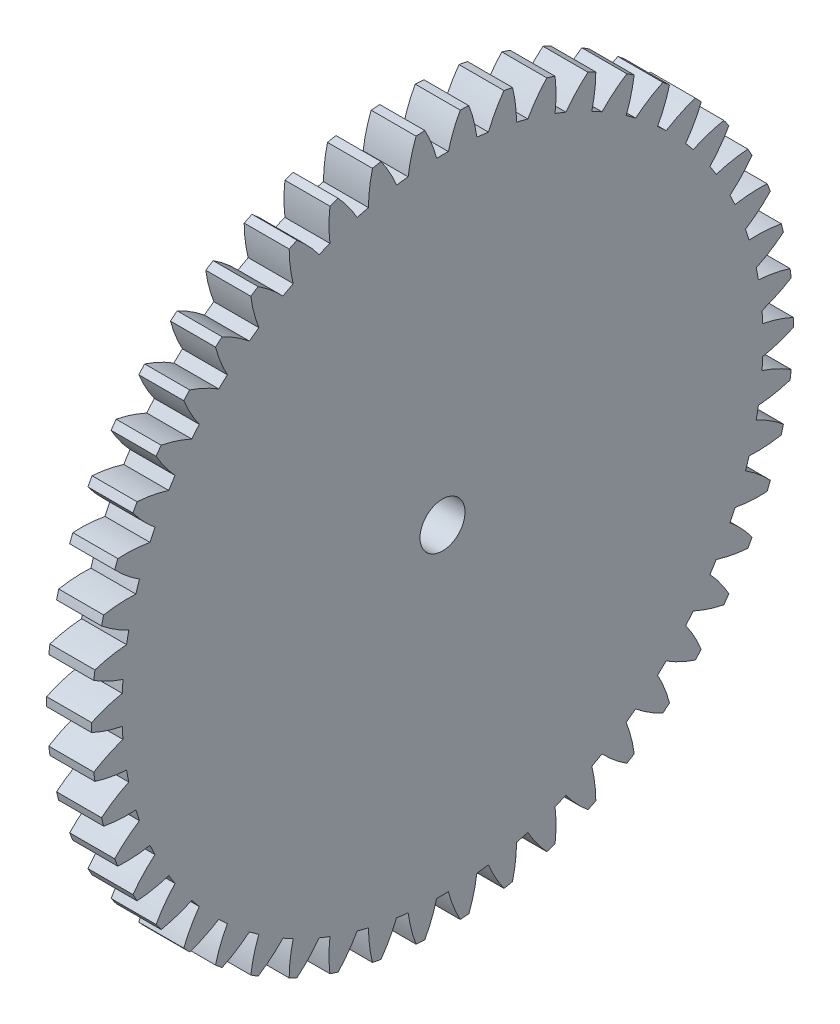
from build123d import *

# Parameters (mm, degrees)
BASPROSKE_W      = 5
BASPROSKE_H      = 39
TOOTHCUT_DEPTH   = 56.380501984
TEETHCUTS_COUNT  = 50
TEETHCUTS_ANGLE  = 352.8
HUBNEAONESKE_R   = 5
HUBNEARONE_DEPTH = 5.0000508
BORSKE_R         = 2.5
BORE_DEPTH       = 10.0000508


with BuildPart() as part:
    # BasProSke → Base-Revolve (revolve)
    with BuildSketch(Plane(origin=(0, 0, 0), x_dir=(1, 0, 0), z_dir=(0, 1, 0)), mode=Mode.PRIVATE) as base_revolve_sk:
        with Locations((2.5, 19.5)):
            Rectangle(BASPROSKE_W, BASPROSKE_H)
    revolve(base_revolve_sk.sketch.rotate(Axis((-10, 0, 0), (1, 0, 0)), 180), axis=Axis((-10, 0, 0), (1, 0, 0)))

    # TooCutSke → ToothCut (cut, through all)
    with BuildSketch(Plane(origin=(0, 0, 0), x_dir=(0, 0, -1), z_dir=(1, 0, 0))):
        with BuildLine():
            ThreePointArc((0.649974317, 35.618069984), (0, 35.624), (-0.649974317, 35.618069984))
            ThreePointArc((-0.649974317, 35.618069984), (-1.213667282, 37.336773563), (-1.980135572, 38.975131921))
            ThreePointArc((-1.980135572, 38.975131921), (0, 39.0254), (1.980135572, 38.975131921))
            ThreePointArc((1.980135572, 38.975131921), (1.213667282, 37.336773563), (0.649974317, 35.618069984))
        make_face()
    toothcut = extrude(amount=TOOTHCUT_DEPTH, mode=Mode.SUBTRACT)

    # TeethCuts: ToothCut ×50 about axis
    teethcuts_axis = Axis((-10, 0, 0), (1, 0, 0))
    for i in range(1, TEETHCUTS_COUNT):
        add(toothcut.rotate(teethcuts_axis, i * TEETHCUTS_ANGLE / (TEETHCUTS_COUNT - 1)), mode=Mode.SUBTRACT)

    # HubNeaOneSke → HubNearOne (add)
    with BuildSketch(Plane.ZY):
        with Locations(Location((0, 0, 0), (0, 0, 180))):
            Circle(HUBNEAONESKE_R)
    extrude(amount=HUBNEARONE_DEPTH)

    # BorSke → Bore (cut, symmetric)
    with BuildSketch(Plane(origin=(0, 0, 0), x_dir=(0, 0, -1), z_dir=(1, 0, 0))):
        with Locations(Location((0, 0, 0), (0, 0, 180))):
            Circle(BORSKE_R)
    extrude(amount=BORE_DEPTH, both=True, mode=Mode.SUBTRACT)


solid = part.part
